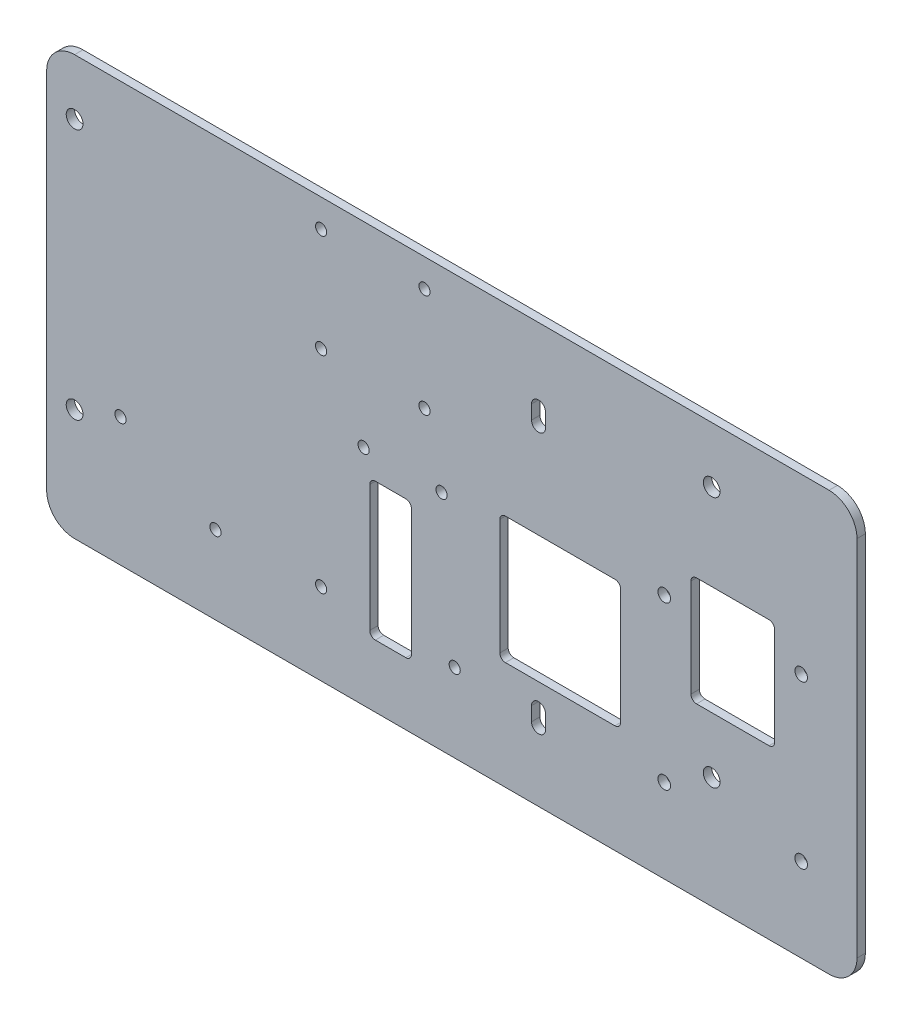
from build123d import *

# Parameters (mm, degrees)
SKETCH_1_W          = 290
SKETCH_1_H          = 150
SKETCH_1_R          = 2.25
SKETCH_1_R_2        = 2
EXTRUDE_1_DEPTH     = 3
SKETCH_5_R          = 3
CUT_EXTRUDE_1_DEPTH = 10
SKETCH_6_W          = 29.947475637
SKETCH_6_H          = 39.048227512
SKETCH_6_W_2        = 43.213980646
SKETCH_6_H_2        = 45.404503952
SKETCH_6_W_3        = 14.915916247
SKETCH_6_H_3        = 49.22754674
CUT_EXTRUDE_2_DEPTH = 10
FILLET_1_R          = 2
FILLET_2_R          = 10


with BuildPart() as part:
    # 스케치1 → 보스-돌출1 (new body)
    with BuildSketch(Plane.XY):
        Rectangle(SKETCH_1_W, SKETCH_1_H)
        with Locations((76.027180087, 13)):
            Circle(SKETCH_1_R, mode=Mode.SUBTRACT)
        with Locations((76.027180087, -45)):
            Circle(SKETCH_1_R, mode=Mode.SUBTRACT)
        with Locations((125.027180087, -45)):
            Circle(SKETCH_1_R, mode=Mode.SUBTRACT)
        with Locations((125.027180087, 13)):
            Circle(SKETCH_1_R, mode=Mode.SUBTRACT)
        with Locations((-118.572819913, -29)):
            Circle(SKETCH_1_R_2, mode=Mode.SUBTRACT)
        with Locations((-84.572819913, -47)):
            Circle(SKETCH_1_R_2, mode=Mode.SUBTRACT)
        with Locations((1.027180087, -46.9)):
            Circle(SKETCH_1_R_2, mode=Mode.SUBTRACT)
        with Locations((-3.672819913, 5)):
            Circle(SKETCH_1_R_2, mode=Mode.SUBTRACT)
        with Locations((-31.572819913, 5)):
            Circle(SKETCH_1_R_2, mode=Mode.SUBTRACT)
        with Locations((-46.772819913, -45.8)):
            Circle(SKETCH_1_R_2, mode=Mode.SUBTRACT)
        with Locations((-9.772819913, 28)):
            Circle(SKETCH_1_R_2, mode=Mode.SUBTRACT)
        with Locations((-46.772819913, 28)):
            Circle(SKETCH_1_R_2, mode=Mode.SUBTRACT)
        with Locations((-46.772819913, 65)):
            Circle(SKETCH_1_R_2, mode=Mode.SUBTRACT)
        with Locations((-9.772819913, 65)):
            Circle(SKETCH_1_R_2, mode=Mode.SUBTRACT)
        with BuildLine():
            Line((28.527180087, 43.5), (28.527180087, 48.5))
            ThreePointArc((28.527180087, 48.5), (31.027180087, 51), (33.527180087, 48.5))
            Line((33.527180087, 48.5), (33.527180087, 43.5))
            ThreePointArc((33.527180087, 43.5), (31.027180087, 41), (28.527180087, 43.5))
        make_face(mode=Mode.SUBTRACT)
        with BuildLine():
            Line((33.527180087, -45), (33.527180087, -50))
            ThreePointArc((33.527180087, -50), (31.027180087, -52.5), (28.527180087, -50))
            Line((28.527180087, -50), (28.527180087, -45))
            ThreePointArc((28.527180087, -45), (31.027180087, -42.5), (33.527180087, -45))
        make_face(mode=Mode.SUBTRACT)
    extrude(amount=-EXTRUDE_1_DEPTH)

    # 스케치5 → 컷-돌출1 (cut)
    with BuildSketch(Plane.XY):
        with Locations((-135, 55)):
            Circle(SKETCH_5_R)
        with Locations((-135, -35)):
            Circle(SKETCH_5_R)
        with Locations((93, 55)):
            Circle(SKETCH_5_R)
        with Locations((93, -35)):
            Circle(SKETCH_5_R)
    extrude(amount=-CUT_EXTRUDE_1_DEPTH, mode=Mode.SUBTRACT)

    # 스케치6 → 컷-돌출2 (cut)
    with BuildSketch(Plane.XY):
        with Locations((100.550839394, 4.607183656)):
            Rectangle(SKETCH_6_W, SKETCH_6_H)
        with Locations((38.78961529, -13.625434023)):
            Rectangle(SKETCH_6_W_2, SKETCH_6_H_2)
        with Locations((-21.905088543, -28.00761485)):
            Rectangle(SKETCH_6_W_3, SKETCH_6_H_3)
    extrude(amount=-CUT_EXTRUDE_2_DEPTH, mode=Mode.SUBTRACT)

    # 필렛1
    fillet_1_edges = [part.edges().sort_by_distance(p)[0] for p in [
        (85.577101575, -14.9169301, -1.5),
        (85.577101575, 24.131297412, -1.5),
        (115.524577212, 24.131297412, -1.5),
        (115.524577212, -14.9169301, -1.5),
        (17.182624967, -36.327685999, -1.5),
        (17.182624967, 9.076817953, -1.5),
        (60.396605613, 9.076817953, -1.5),
        (60.396605613, -36.327685999, -1.5),
        (-29.363046666, -52.62138822, -1.5),
        (-29.363046666, -3.39384148, -1.5),
        (-14.447130419, -3.39384148, -1.5),
        (-14.447130419, -52.62138822, -1.5),
    ]]
    fillet(fillet_1_edges, radius=FILLET_1_R)

    # 필렛2
    fillet_2_edges = [part.edges().sort_by_distance(p)[0] for p in [
        (-145, 75, -1.5),
        (145, 75, -1.5),
        (145, -75, -1.5),
        (-145, -75, -1.5),
    ]]
    fillet(fillet_2_edges, radius=FILLET_2_R)


solid = part.part
